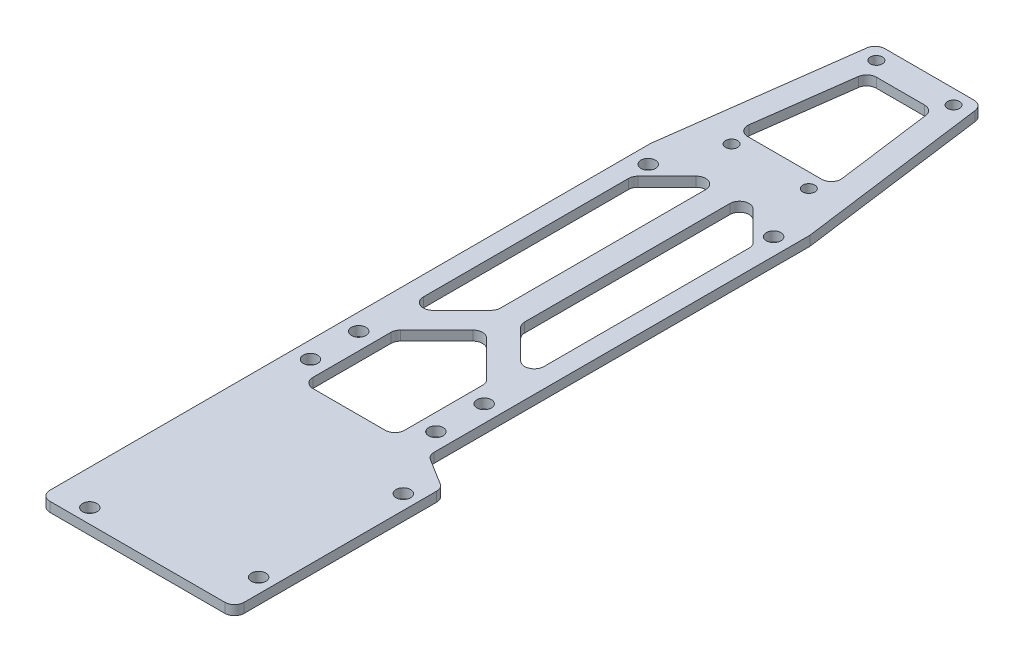
from build123d import *

# Parameters (mm, degrees)
SKETCH_1_R          = 1.25
SKETCH_1_R_2        = 1.5
EXTRUDE_1_DEPTH     = 2
CUT_EXTRUDE_1_DEPTH = 10
FILLET_1_R          = 2


with BuildPart() as part:
    # 草图1 → 凸台-拉伸1 (new body)
    with BuildSketch(Plane(origin=(0, 0, 0), x_dir=(1, 0, 0), z_dir=(0, 1, 0))):
        Polygon((11, 0), (-11, 0), (-16.5, -41.3), (-16.5, -120.3), (-16.5, -167.8), (23.75, -167.8), (23.75, -124.8), (16.5, -120.3), (16.5, -41.3), align=None)
        with Locations(Location((-8, -3, 0), (0, 0, 270))):
            Circle(SKETCH_1_R, mode=Mode.SUBTRACT)
        with Locations(Location((-8, -33, 0), (0, 0, 270))):
            Circle(SKETCH_1_R, mode=Mode.SUBTRACT)
        with Locations(Location((8, -33, 0), (0, 0, 90))):
            Circle(SKETCH_1_R, mode=Mode.SUBTRACT)
        with Locations(Location((8, -3, 0), (0, 0, 90))):
            Circle(SKETCH_1_R, mode=Mode.SUBTRACT)
        with Locations(Location((-13, -45.3, 0), (0, 0, 270))):
            Circle(SKETCH_1_R_2, mode=Mode.SUBTRACT)
        with Locations(Location((-13, -105.3, 0), (0, 0, 270))):
            Circle(SKETCH_1_R_2, mode=Mode.SUBTRACT)
        with Locations(Location((-13, -115.3, 0), (0, 0, 270))):
            Circle(SKETCH_1_R_2, mode=Mode.SUBTRACT)
        with Locations(Location((13, -115.3, 0), (0, 0, 90))):
            Circle(SKETCH_1_R_2, mode=Mode.SUBTRACT)
        with Locations(Location((13, -105.3, 0), (0, 0, 90))):
            Circle(SKETCH_1_R_2, mode=Mode.SUBTRACT)
        with Locations(Location((13, -45.3, 0), (0, 0, 90))):
            Circle(SKETCH_1_R_2, mode=Mode.SUBTRACT)
        with Locations(Location((20.75, -129.8, 0), (0, 0, 270))):
            Circle(SKETCH_1_R_2, mode=Mode.SUBTRACT)
        with Locations(Location((20.75, -159.8, 0), (0, 0, 90))):
            Circle(SKETCH_1_R_2, mode=Mode.SUBTRACT)
        with Locations(Location((-9.25, -164.8, 0), (0, 0, 270))):
            Circle(SKETCH_1_R_2, mode=Mode.SUBTRACT)
    extrude(amount=EXTRUDE_1_DEPTH)

    # 草图2 → 切除-拉伸1 (cut)
    with BuildSketch(Plane(origin=(0, 2, 0), x_dir=(1, 0, 0), z_dir=(0, 1, 0))):
        Polygon((6.754889433, -6), (-6.754889433, -6), (-9.951015341, -30), (9.951015341, -30), align=None)
        Polygon((12.5, -97.228932188), (2.5, -87.228932188), (2.5, -39.042640687), (12.5, -49.042640687), align=None)
        Polygon((-12.5, -49.042640687), (-2.5, -39.042640687), (-2.5, -87.228932188), (-12.5, -97.228932188), align=None)
        Polygon((-9.5, -101.3), (0, -91.8), (9.5, -101.3), (9.5, -120.3), (-9.5, -120.3), align=None)
    extrude(amount=-CUT_EXTRUDE_1_DEPTH, mode=Mode.SUBTRACT)

    # 圆角1
    fillet_1_edges = [part.edges().sort_by_distance(p)[0] for p in [
        (-9.951015341, 1, 30),
        (-6.754889433, 1, 6),
        (6.754889433, 1, 6),
        (9.951015341, 1, 30),
        (0, 1, 91.8),
        (9.5, 1, 101.3),
        (9.5, 1, 120.3),
        (-9.5, 1, 120.3),
        (-9.5, 1, 101.3),
        (12.5, 1, 49.042640687),
        (12.5, 1, 97.228932188),
        (2.5, 1, 87.228932188),
        (2.5, 1, 39.042640687),
        (-12.5, 1, 97.228932188),
        (-12.5, 1, 49.042640687),
        (-2.5, 1, 39.042640687),
        (-2.5, 1, 87.228932188),
        (23.75, 1, 124.8),
        (23.75, 1, 167.8),
        (-16.5, 1, 167.8),
        (-11, 1, 0),
        (11, 1, 0),
        (16.5, 1, 120.3),
    ]]
    fillet(fillet_1_edges, radius=FILLET_1_R)


solid = part.part
